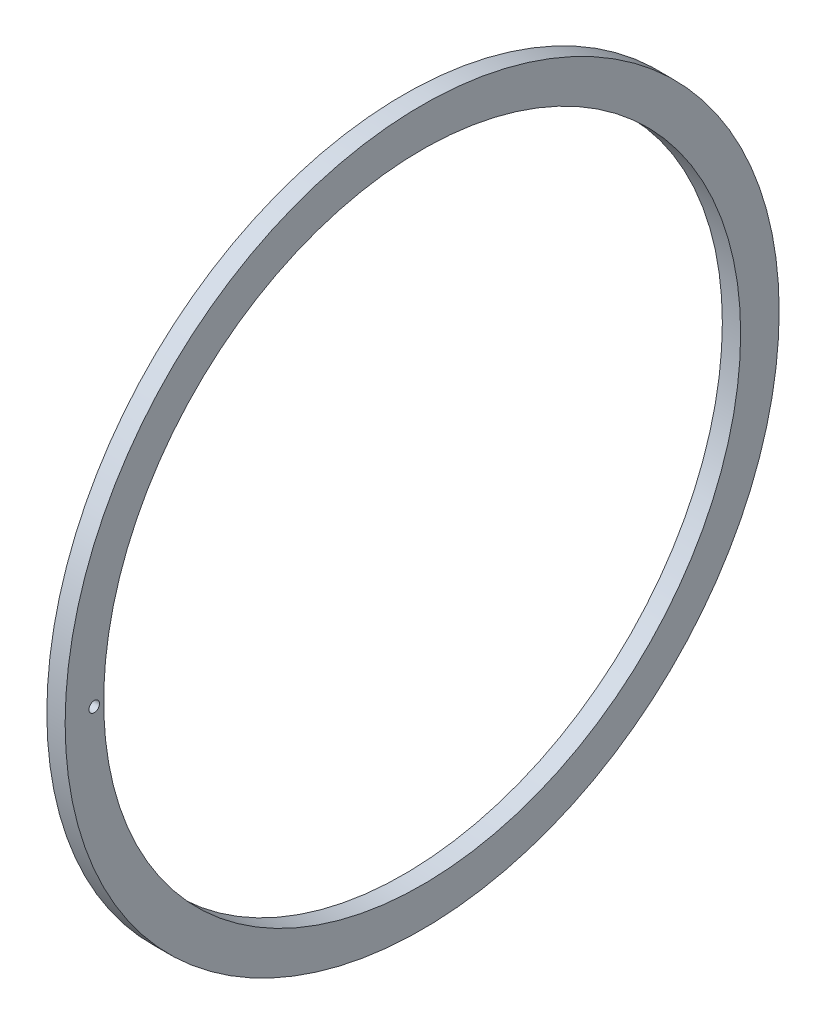
from build123d import *

# Parameters (mm, degrees)
SKETCH1_R               = 195
SKETCH1_R_2             = 2.89935
BOSS_EXTRUDE1_DEPTH     = 10
CUT_EXTRUDE1_DEPTH      = 276.952894531
CUT_EXTRUDE1_DEPTH_BACK = 276.952894531
SKETCH2_R               = 173.961


with BuildPart() as part:
    # Sketch1 → Boss-Extrude1 (new body)
    with BuildSketch(Plane(origin=(0, 0, 0), x_dir=(0, 0, -1), z_dir=(1, 0, 0))):
        Circle(SKETCH1_R)
        with Locations((-179.1136862, 0)):
            Circle(SKETCH1_R_2, mode=Mode.SUBTRACT)
    extrude(amount=BOSS_EXTRUDE1_DEPTH)

    # Sketch2 → Cut-Extrude1 (cut, two sides: drawn at the far end of the back side and taken through both)
    with BuildSketch(Plane(origin=(10, 0, 0), x_dir=(0, 0, -1), z_dir=(1, 0, 0)).offset(-CUT_EXTRUDE1_DEPTH_BACK)):
        Circle(SKETCH2_R)
    extrude(amount=CUT_EXTRUDE1_DEPTH + CUT_EXTRUDE1_DEPTH_BACK, mode=Mode.SUBTRACT)


solid = part.part
